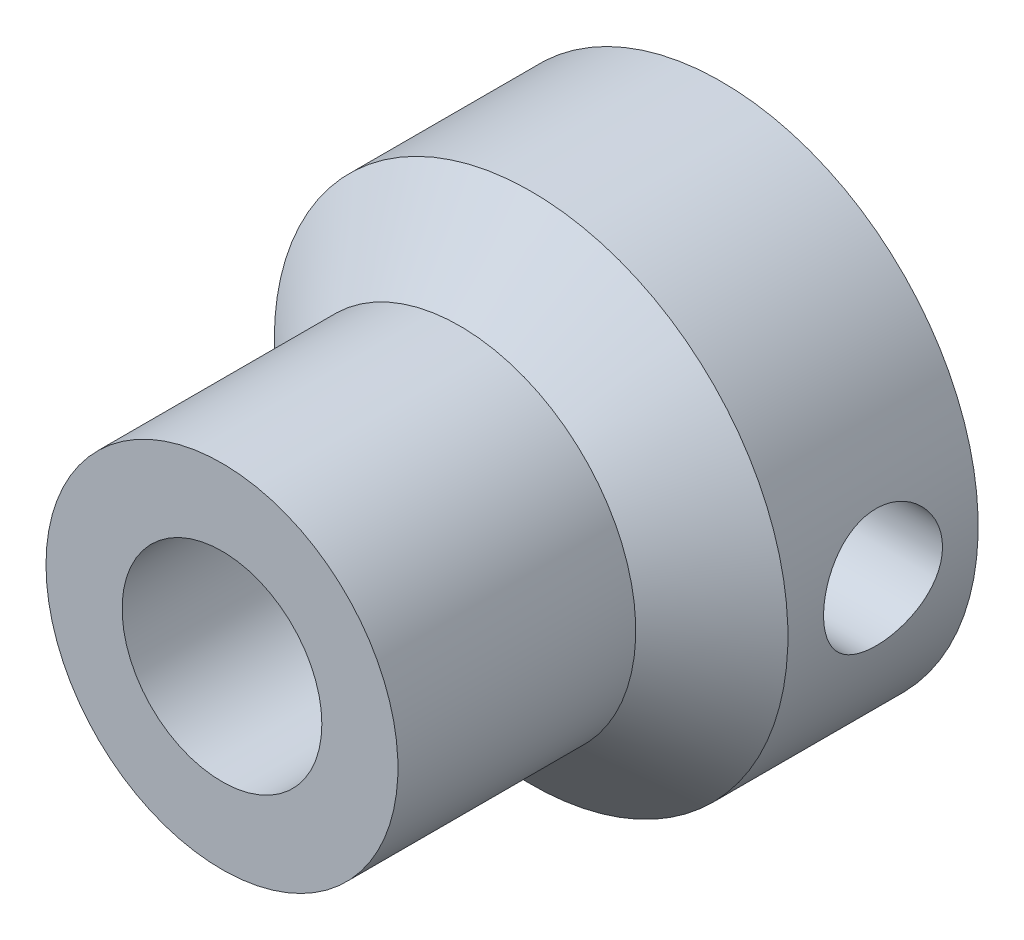
from build123d import *

# Parameters (mm, degrees)
CONNECTOR_M5X0_8_TAPPED_HOLE_D        = 4.2
SET_SCREW_1_M3X0_5_TAPPED_HOLE_REACH  = 16.767
SET_SCREW_1_M3X0_5_TAPPED_HOLE_BORE_R = 1.25
SET_SCREW_2_PATTERN_COUNT             = 2


with BuildPart() as part:
    # Body Sketch → Body Revolve (revolve)
    with BuildSketch(Plane(origin=(0, 0, 0), x_dir=(-1, 0, 0), z_dir=(0, 1, 0))):
        Polygon((1, 10.5), (3.7, 10.5), (3.7, 5.5), (5.4, 4), (5.4, 0), (2.5, 0), (2.5, 5), (1, 5), align=None)
    revolve(axis=Axis((0, 0, 0), (0, 0, 1)))

    # Connector M5x0.8 Tapped Hole (through all)
    with Locations(Plane.XY.offset(10.5)):
        with Locations((0, 0)):
            Hole(CONNECTOR_M5X0_8_TAPPED_HOLE_D / 2)

    # Set Screw 1 M3x0.5 Tapped Hole bore (on position points) → Set Screw 1 M3x0.5 Tapped Hole (cut, up to next)
    with BuildSketch(Plane(origin=(5.4, 0, 2), x_dir=(0, 1, 0), z_dir=(1, 0, 0)), mode=Mode.PRIVATE) as set_screw_1_m3x0_5_tapped_hole_sk1:
        Circle(SET_SCREW_1_M3X0_5_TAPPED_HOLE_BORE_R)
    set_screw_1_m3x0_5_tapped_hole_tool1 = extrude(set_screw_1_m3x0_5_tapped_hole_sk1.sketch, amount=-SET_SCREW_1_M3X0_5_TAPPED_HOLE_REACH, mode=Mode.PRIVATE) & part.part
    set_screw_1_m3x0_5_tapped_hole = set_screw_1_m3x0_5_tapped_hole_tool1.solids().sort_by_distance((5.4, 0, 2))[0]
    add(set_screw_1_m3x0_5_tapped_hole, mode=Mode.SUBTRACT)

    # Set Screw 2 Pattern: Set Screw 1 M3x0.5 Tapped Hole ×2 about axis
    set_screw_2_pattern_axis = Axis((0, 0, 0), (0, 0, 1))
    for i in range(1, SET_SCREW_2_PATTERN_COUNT):
        add(set_screw_1_m3x0_5_tapped_hole.rotate(set_screw_2_pattern_axis, i * 360 / SET_SCREW_2_PATTERN_COUNT), mode=Mode.SUBTRACT)


solid = part.part
